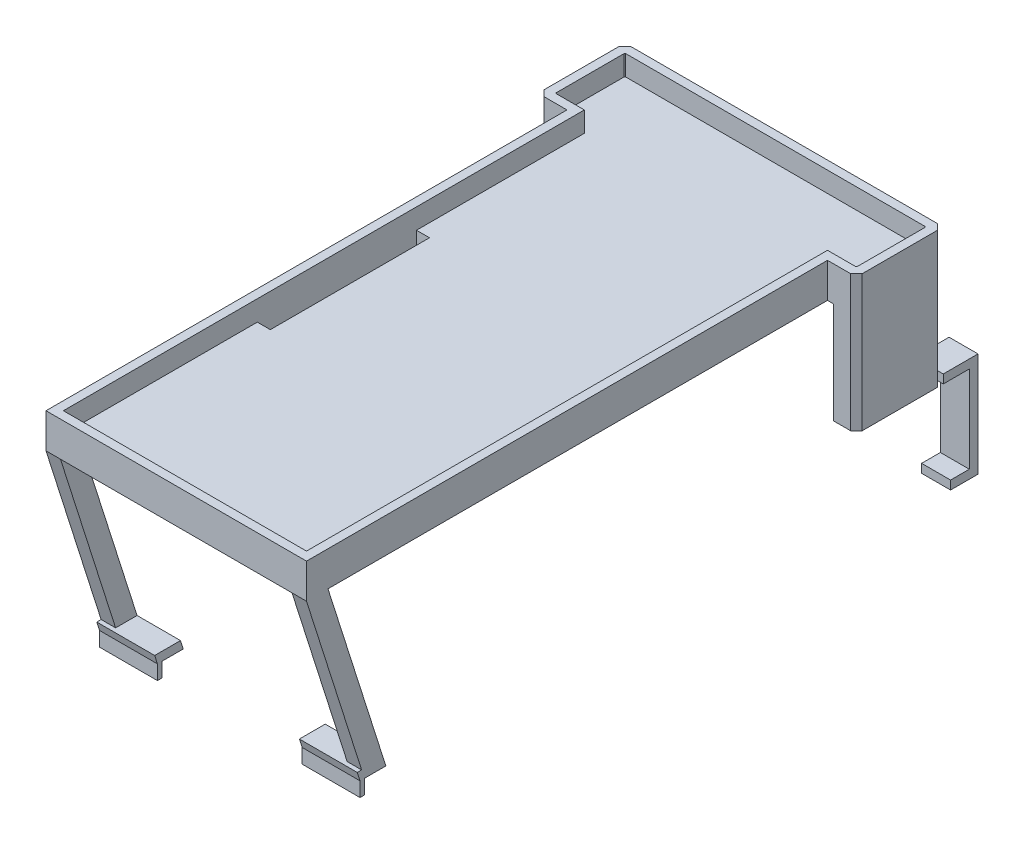
from build123d import *

# Parameters (mm, degrees)
BOSS_EXTRUDE1_DEPTH = 5
SKETCH2_W           = 4.5
SKETCH2_H           = 55
CUT_EXTRUDE1_DEPTH  = 198.863589374
BOSS_EXTRUDE2_START = -5
SKETCH3_W           = 10
SKETCH3_H           = 30
BOSS_EXTRUDE2_DEPTH = 35
CHAMFER1_SIZE       = 2
SKETCH5_W           = 90
SKETCH5_H           = 5
BOSS_EXTRUDE3_DEPTH = 20
BOSS_EXTRUDE4_DEPTH = 5
BOSS_EXTRUDE5_DEPTH = 15
BOSS_EXTRUDE6_DEPTH = 20
BOSS_EXTRUDE7_DEPTH = 7
BOSS_EXTRUDE8_REACH = 248.625


with BuildPart() as part:
    # Sketch1 → Boss-Extrude1 (new body)
    with BuildSketch(Plane(origin=(0, 0, 0), x_dir=(1, 0, 0), z_dir=(0, 1, 0))):
        Polygon((-45, -30), (-45, -190), (45, -190), (45, -30), (55, -30), (55, 0), (-55, 0), (-55, -30), align=None)
    extrude(amount=BOSS_EXTRUDE1_DEPTH)

    # Sketch2 → Cut-Extrude1 (cut, through all)
    with BuildSketch(Plane(origin=(0, 5, 0), x_dir=(1, 0, 0), z_dir=(0, 1, 0))):
        with Locations((39.75, -112.5)):
            Rectangle(SKETCH2_W, SKETCH2_H)
        with Locations((-39.75, -112.5)):
            Rectangle(SKETCH2_W, SKETCH2_H)
    extrude(amount=-CUT_EXTRUDE1_DEPTH, mode=Mode.SUBTRACT)

    # Sketch3 → Boss-Extrude2 (add)
    with BuildSketch(Plane(origin=(0, 5, 0), x_dir=(1, 0, 0), z_dir=(0, 1, 0)).offset(BOSS_EXTRUDE2_START)):
        with Locations((50, -15)):
            Rectangle(SKETCH3_W, SKETCH3_H)
        with Locations((-50, -15)):
            Rectangle(SKETCH3_W, SKETCH3_H)
    extrude(amount=-BOSS_EXTRUDE2_DEPTH)

    # Chamfer1
    chamfer1_edges = [part.edges().sort_by_distance(p)[0] for p in [
        (-55, -15, 30),
        (-55, -15, 0),
        (55, -15, 0),
        (55, -15, 30),
        (45, -17.5, 30),
        (45, -17.5, 0),
        (-45, -17.5, 0),
        (-45, -17.5, 30),
    ]]
    chamfer(chamfer1_edges, length=CHAMFER1_SIZE)

    # Sketch5 → Boss-Extrude3 (add)
    with BuildSketch(Plane.XY.offset(190)):
        with Locations((0, 2.5)):
            Rectangle(SKETCH5_W, SKETCH5_H)
    extrude(amount=BOSS_EXTRUDE3_DEPTH)

    # Sketch8 → Boss-Extrude4 (add)
    with BuildSketch(Plane.ZY.offset(45)):
        Polygon((202.579910044, 0), (182.579910044, -63), (190, -63), (210, 0), align=None)
    boss_extrude4 = extrude(amount=-BOSS_EXTRUDE4_DEPTH)

    # Sketch9 → Boss-Extrude5 (add)
    with BuildSketch(Plane(origin=(-40, 0, 0), x_dir=(0, 0, -1), z_dir=(1, 0, 0))):
        Polygon((-190.952380952, -60), (-183.532290996, -60), (-182.579910044, -63), (-190, -63), align=None)
    boss_extrude5 = extrude(amount=BOSS_EXTRUDE5_DEPTH)

    # Sketch10 → Boss-Extrude6 (add)
    with BuildSketch(Plane.ZY.offset(45)):
        Polygon((190, -68), (190, -63), (190.952380952, -60), (192.452380952, -60), (191.5, -63), (191.5, -68), align=None)
    boss_extrude6 = extrude(amount=-BOSS_EXTRUDE6_DEPTH)

    # Mirror1: Boss-Extrude4, Boss-Extrude5, Boss-Extrude6 across plane
    add(boss_extrude4.mirror(Plane(origin=(0, 0, 0), x_dir=(0, 0, 1), z_dir=(1, 0, 0))))
    add(boss_extrude5.mirror(Plane(origin=(0, 0, 0), x_dir=(0, 0, 1), z_dir=(1, 0, 0))))
    add(boss_extrude6.mirror(Plane(origin=(0, 0, 0), x_dir=(0, 0, 1), z_dir=(1, 0, 0))))

    # Sketch11 → Boss-Extrude7 (add)
    with BuildSketch(Plane(origin=(0, 5, 0), x_dir=(1, 0, 0), z_dir=(0, 1, 0))):
        Polygon((45, -210), (45, -30), (53, -30), (55, -28), (55, -2), (53, 0), (-53, 0), (-55, -2), (-55, -28), (-53, -30), (-45, -30), (-45, -210), align=None)
        Polygon((51.757359313, -27), (42, -27), (42, -85), (42, -140), (42, -207), (-42, -207), (-42, -140), (-42, -85), (-42, -27), (-51.757359313, -27), (-52, -26.757359313), (-52, -3.242640687), (-51.757359313, -3), (51.757359313, -3), (52, -3.242640687), (52, -26.757359313), align=None, mode=Mode.SUBTRACT)
    extrude(amount=BOSS_EXTRUDE7_DEPTH)

    # Boss-Extrude8: up to this face of the body (flat: up to its plane)
    boss_extrude8_end = Plane(part.part.faces().sort_by_distance((45, -17.5, 15))[0])
    # Sketch12 → Boss-Extrude8 (add, up to the picked face)
    with BuildSketch(Plane(origin=(55, 0, 0), x_dir=(0, 0, -1), z_dir=(1, 0, 0)), mode=Mode.PRIVATE) as boss_extrude8_sk1:
        Polygon((0, -32), (12, -32), (12, -68), (2.5183809, -68), (2.5183809, -65), (9, -65), (9, -35), (0, -35), align=None)
    boss_extrude8_tool1 = split(extrude(boss_extrude8_sk1.sketch, amount=-BOSS_EXTRUDE8_REACH, mode=Mode.PRIVATE), bisect_by=boss_extrude8_end, keep=Keep.BOTH, mode=Mode.PRIVATE)
    add(boss_extrude8_tool1.solids().sort_by(Axis((55, -32.379473, -6), (-1, 0, 0)))[0])


solid = part.part
